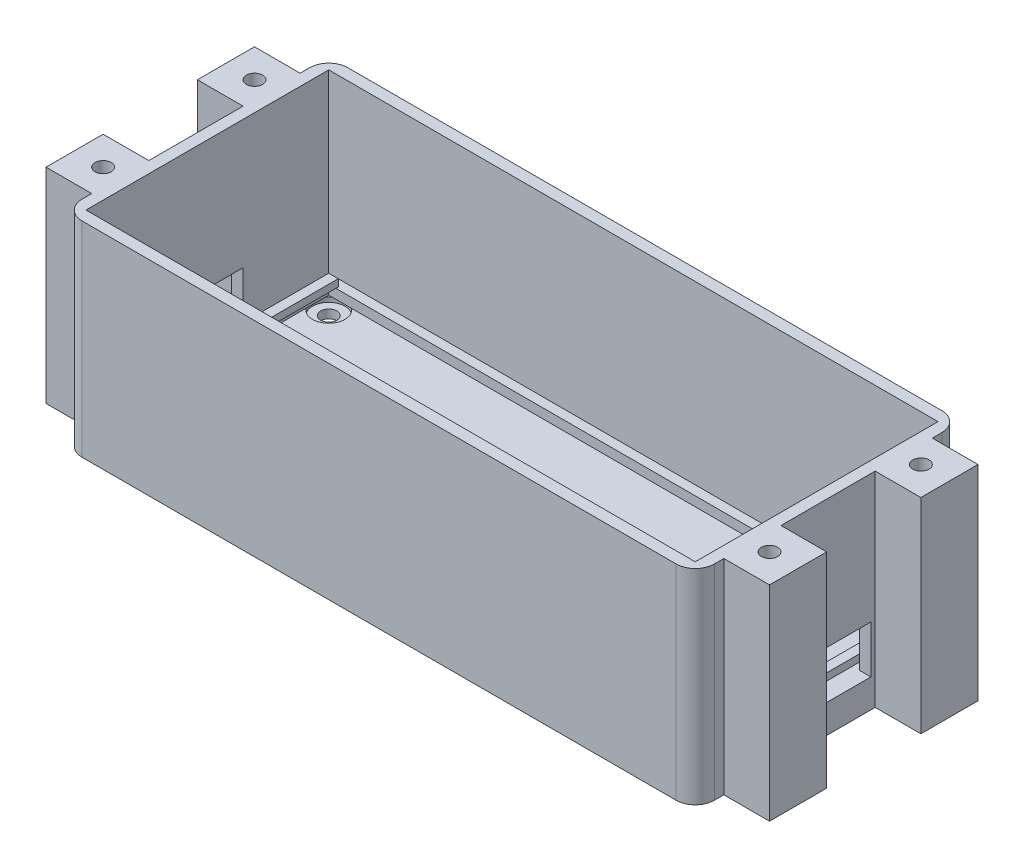
from build123d import *

# Parameters (mm, degrees)
SHELL_DEPTH                       = 43
SK_TABS_W                         = 9.6
SK_TABS_H                         = 12
MOUNTING_TABS_DEPTH               = 43
SK_CAVITY_W                       = 128
SK_CAVITY_H                       = 51
CAVITY_DEPTH                      = 159.137408604
SK_LIP_W                          = 128
SK_LIP_H                          = 51
SK_LIP_W_2                        = 124
SK_LIP_H_2                        = 47
BOARD_LIP_DEPTH                   = 2
SK_RAILS_W                        = 2
SK_RAILS_H                        = 48
BOARD_RAILS_DEPTH                 = 1.5
SK_SLOTA_W                        = 15
SK_SLOTA_H                        = 10
CABLE_SLOT_15X10_DEPTH            = 3
SK_SLOTB_W                        = 18
SK_SLOTB_H                        = 10
CABLE_SLOT_18X10_DEPTH            = 3
TAB_M3_CLEARANCE_HOLES_DEPTH      = 159.872275744
TAB_M3_CLEARANCE_HOLES_DEPTH_BACK = 159.872275744
SK_TABHOLES_R                     = 1.7
SK_FLOORHOLES_R                   = 1.7
FLOOR_M3_CLEARANCE_HOLES_DEPTH    = 2.8
SK_CBORE_R                        = 3.4
FLOOR_COUNTERBORES_DEPTH          = 1


with BuildPart() as part:
    # Sk_Shell → Shell (new body)
    with BuildSketch(Plane(origin=(0, 0, 0), x_dir=(1, 0, 0), z_dir=(0, 1, 0))):
        with BuildLine():
            Line((4, 0), (128.8, 0))
            ThreePointArc((128.8, 0), (131.628427125, 1.171572875), (132.8, 4))
            Line((132.8, 4), (132.8, 51.8))
            ThreePointArc((132.8, 51.8), (131.628427125, 54.628427125), (128.8, 55.8))
            Line((128.8, 55.8), (4, 55.8))
            ThreePointArc((4, 55.8), (1.171572875, 54.628427125), (0, 51.8))
            Line((0, 51.8), (0, 4))
            ThreePointArc((0, 4), (1.171572875, 1.171572875), (4, 0))
        make_face()
    extrude(amount=SHELL_DEPTH)

    # Sk_Tabs → Mounting Tabs (add)
    with BuildSketch(Plane(origin=(0, 0, 0), x_dir=(1, 0, 0), z_dir=(0, 1, 0))):
        with Locations((-4.8, 12)):
            Rectangle(SK_TABS_W, SK_TABS_H)
        with Locations((137.6, 12)):
            Rectangle(SK_TABS_W, SK_TABS_H)
        with Locations((-4.8, 43.8)):
            Rectangle(SK_TABS_W, SK_TABS_H)
        with Locations((137.6, 43.8)):
            Rectangle(SK_TABS_W, SK_TABS_H)
    extrude(amount=MOUNTING_TABS_DEPTH)

    # Sk_Cavity → Cavity (cut, through all)
    with BuildSketch(Plane(origin=(0, 2.8, 0), x_dir=(1, 0, 0), z_dir=(0, 1, 0))):
        with Locations((66.4, 27.9)):
            Rectangle(SK_CAVITY_W, SK_CAVITY_H)
    extrude(amount=CAVITY_DEPTH, mode=Mode.SUBTRACT)

    # Sk_Lip → Board Lip (add)
    with BuildSketch(Plane(origin=(0, 4, 0), x_dir=(1, 0, 0), z_dir=(0, 1, 0))):
        with Locations((66.4, 27.9)):
            Rectangle(SK_LIP_W, SK_LIP_H)
        with Locations((66.4, 27.9)):
            Rectangle(SK_LIP_W_2, SK_LIP_H_2, mode=Mode.SUBTRACT)
    extrude(amount=BOARD_LIP_DEPTH)

    # Sk_Rails → Board Rails (add)
    with BuildSketch(Plane(origin=(0, 6, 0), x_dir=(1, 0, 0), z_dir=(0, 1, 0))):
        with Locations((4.9, 27.9)):
            Rectangle(SK_RAILS_W, SK_RAILS_H)
        with Locations((127.9, 27.9)):
            Rectangle(SK_RAILS_W, SK_RAILS_H)
    extrude(amount=BOARD_RAILS_DEPTH)

    # Sk_SlotA → Cable Slot 15x10 (cut)
    with BuildSketch(Plane(origin=(0, 0, 0), x_dir=(0, 0, -1), z_dir=(1, 0, 0))):
        with Locations((27.9, 11)):
            Rectangle(SK_SLOTA_W, SK_SLOTA_H)
    extrude(amount=CABLE_SLOT_15X10_DEPTH, mode=Mode.SUBTRACT)

    # Sk_SlotB → Cable Slot 18x10 (cut)
    with BuildSketch(Plane(origin=(132.8, 0, 0), x_dir=(0, 0, -1), z_dir=(1, 0, 0))):
        with Locations((27.9, 11)):
            Rectangle(SK_SLOTB_W, SK_SLOTB_H)
    extrude(amount=-CABLE_SLOT_18X10_DEPTH, mode=Mode.SUBTRACT)

    # Sk_TabHoles → Tab M3 Clearance Holes (cut, two sides: drawn at the far end of the back side and taken through both)
    with BuildSketch(Plane(origin=(0, 0, 0), x_dir=(1, 0, 0), z_dir=(0, 1, 0)).offset(-TAB_M3_CLEARANCE_HOLES_DEPTH_BACK)):
        with Locations(Location((-3.6, 12, 0), (0, 0, 270))):
            Circle(SK_TABHOLES_R)
        with Locations(Location((-3.6, 43.8, 0), (0, 0, 270))):
            Circle(SK_TABHOLES_R)
        with Locations(Location((136.4, 12, 0), (0, 0, 270))):
            Circle(SK_TABHOLES_R)
        with Locations(Location((136.4, 43.8, 0), (0, 0, 270))):
            Circle(SK_TABHOLES_R)
    extrude(amount=TAB_M3_CLEARANCE_HOLES_DEPTH + TAB_M3_CLEARANCE_HOLES_DEPTH_BACK, mode=Mode.SUBTRACT)

    # Sk_FloorHoles → Floor M3 Clearance Holes (cut)
    with BuildSketch(Plane(origin=(0, 0, 0), x_dir=(1, 0, 0), z_dir=(0, 1, 0))):
        with Locations(Location((5.9, 5.9, 0), (0, 0, 270))):
            Circle(SK_FLOORHOLES_R)
        with Locations(Location((126.9, 5.9, 0), (0, 0, 270))):
            Circle(SK_FLOORHOLES_R)
        with Locations(Location((5.9, 49.9, 0), (0, 0, 270))):
            Circle(SK_FLOORHOLES_R)
        with Locations(Location((126.9, 49.9, 0), (0, 0, 270))):
            Circle(SK_FLOORHOLES_R)
    extrude(amount=FLOOR_M3_CLEARANCE_HOLES_DEPTH, mode=Mode.SUBTRACT)

    # Sk_CBore → Floor Counterbores (cut)
    with BuildSketch(Plane(origin=(0, 2.8, 0), x_dir=(1, 0, 0), z_dir=(0, 1, 0))):
        with Locations(Location((5.9, 5.9, 0), (0, 0, 270))):
            Circle(SK_CBORE_R)
        with Locations(Location((126.9, 5.9, 0), (0, 0, 270))):
            Circle(SK_CBORE_R)
        with Locations(Location((5.9, 49.9, 0), (0, 0, 270))):
            Circle(SK_CBORE_R)
        with Locations(Location((126.9, 49.9, 0), (0, 0, 270))):
            Circle(SK_CBORE_R)
    extrude(amount=-FLOOR_COUNTERBORES_DEPTH, mode=Mode.SUBTRACT)


solid = part.part
